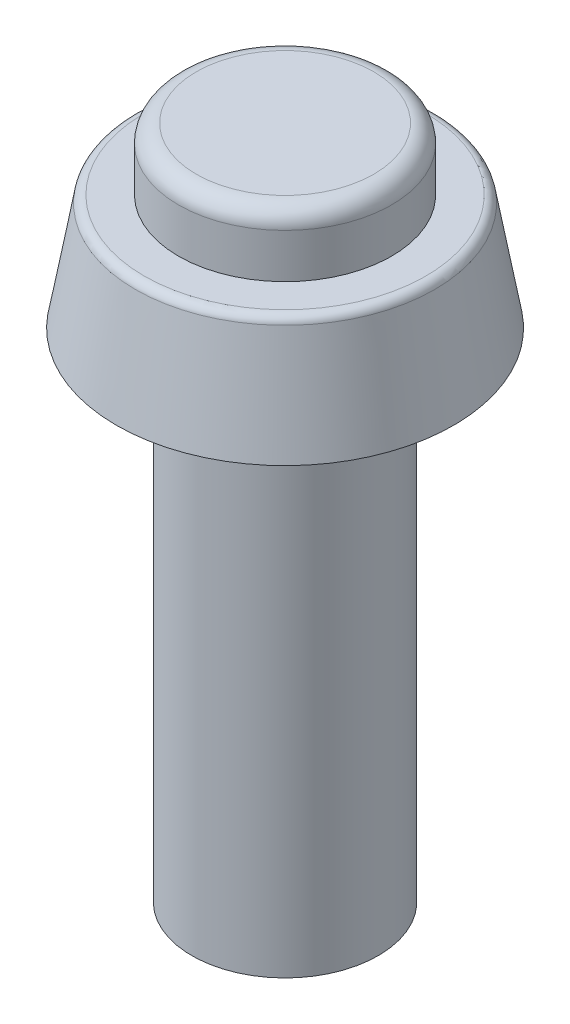
from build123d import *

# Parameters (mm, degrees)
SKETCH1_R           = 9.5
BOSS_EXTRUDE1_DEPTH = 6.5
BOSS_EXTRUDE1_TAPER = 10
SKETCH2_R           = 6
BOSS_EXTRUDE2_DEPTH = 3.5
SKETCH3_R           = 5.25
BOSS_EXTRUDE3_DEPTH = 28
FILLET1_R           = 1
FILLET2_R           = 0.5


with BuildPart() as part:
    # Sketch1 → Boss-Extrude1 (new body)
    with BuildSketch(Plane(origin=(0, 0, 0), x_dir=(1, 0, 0), z_dir=(0, 1, 0))):
        Circle(SKETCH1_R)
    extrude(amount=BOSS_EXTRUDE1_DEPTH, taper=BOSS_EXTRUDE1_TAPER)

    # Sketch3 → Boss-Extrude3 (add)
    with BuildSketch(Plane.XZ):
        with Locations(Location((0, 0, 0), (0, 0, 270))):
            Circle(SKETCH3_R)
    extrude(amount=BOSS_EXTRUDE3_DEPTH)

    # Fillet2
    fillet2_edges = [part.edges().sort_by_distance(p)[0] for p in [
        (-8.353874625, 6.5, 0),
    ]]
    fillet(fillet2_edges, radius=FILLET2_R)


with BuildPart() as body_2:
    # Sketch2 → Boss-Extrude2 (new body)
    with BuildSketch(Plane(origin=(0, 6.5, 0), x_dir=(1, 0, 0), z_dir=(0, 1, 0))):
        with Locations(Location((0, 0, 0), (0, 0, 270))):
            Circle(SKETCH2_R)
    extrude(amount=BOSS_EXTRUDE2_DEPTH)

    # Fillet1
    fillet1_edges = [body_2.edges().sort_by_distance(p)[0] for p in [
        (0, 10, -6),
    ]]
    fillet(fillet1_edges, radius=FILLET1_R)


solid = Compound([part.part, body_2.part])
